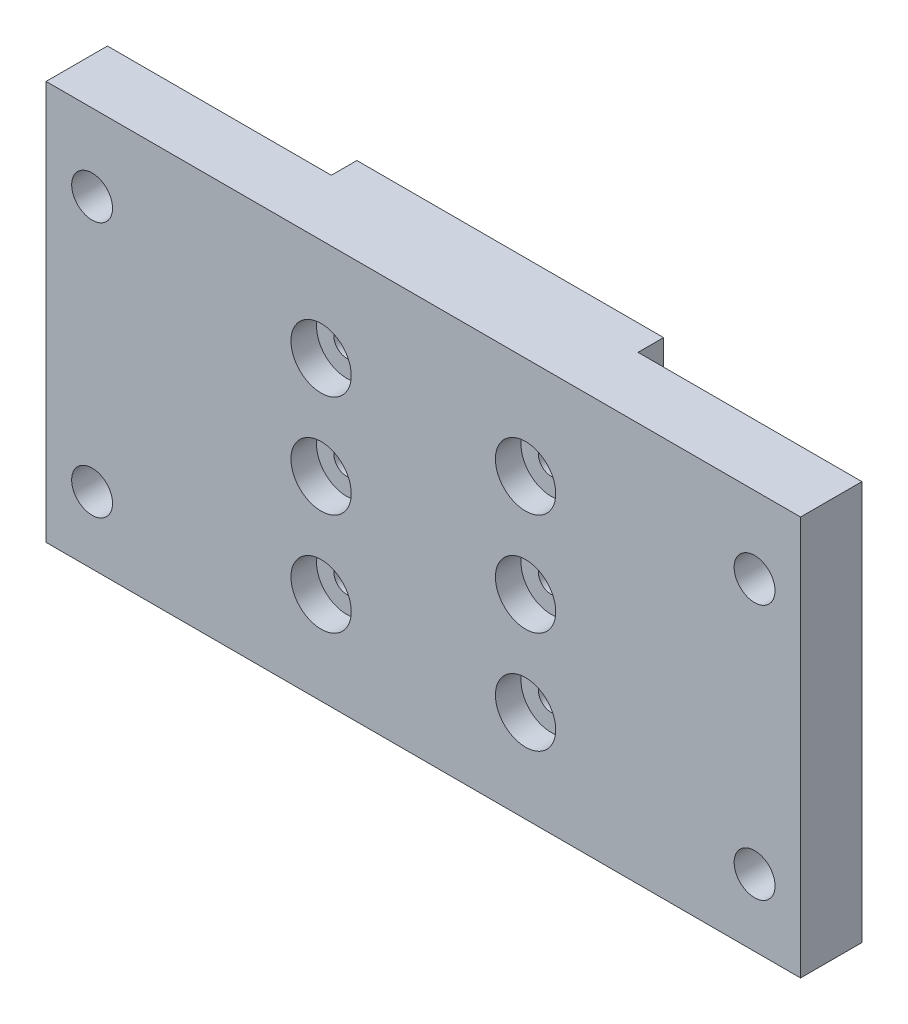
from build123d import *

# Parameters (mm, degrees)
SKETCH1_W           = 147.6
SKETCH1_H           = 78.1
BOSS_EXTRUDE1_DEPTH = 12
SKETCH2_W           = 60
SKETCH2_H           = 78.1
BOSS_EXTRUDE2_DEPTH = 5
SKETCH3_R           = 2.5
CUT_EXTRUDE1_DEPTH  = 86.207643436
SKETCH4_R           = 4
CUT_EXTRUDE2_DEPTH  = 86.207643436
SKETCH5_R           = 5.9
CUT_EXTRUDE3_DEPTH  = 5


with BuildPart() as part:
    # Sketch1 → Boss-Extrude1 (new body)
    with BuildSketch(Plane.XY):
        Rectangle(SKETCH1_W, SKETCH1_H)
    extrude(amount=BOSS_EXTRUDE1_DEPTH)

    # Sketch2 → Boss-Extrude2 (add)
    with BuildSketch(Plane(origin=(0, 0, 0), x_dir=(-1, 0, 0), z_dir=(0, 0, -1))):
        Rectangle(SKETCH2_W, SKETCH2_H)
    extrude(amount=BOSS_EXTRUDE2_DEPTH)

    # Sketch3 → Cut-Extrude1 (cut, through all)
    with BuildSketch(Plane(origin=(0, 0, -5), x_dir=(-1, 0, 0), z_dir=(0, 0, -1))):
        with Locations((-20, 19.05)):
            Circle(SKETCH3_R)
        with Locations((-20, -0.95)):
            Circle(SKETCH3_R)
        with Locations((-20, -20.95)):
            Circle(SKETCH3_R)
        with Locations(Location((20, -20.95, 0), (0, 0, 180))):
            Circle(SKETCH3_R)
        with Locations(Location((20, -0.95, 0), (0, 0, 180))):
            Circle(SKETCH3_R)
        with Locations(Location((20, 19.05, 0), (0, 0, 180))):
            Circle(SKETCH3_R)
    extrude(amount=-CUT_EXTRUDE1_DEPTH, mode=Mode.SUBTRACT)

    # Sketch4 → Cut-Extrude2 (cut, through all)
    with BuildSketch(Plane.XY.offset(12)):
        with Locations((64.8, 24.05)):
            Circle(SKETCH4_R)
        with Locations((64.8, -25.95)):
            Circle(SKETCH4_R)
        with Locations(Location((-64.8, -25.95, 0), (0, 0, 180))):
            Circle(SKETCH4_R)
        with Locations(Location((-64.8, 24.05, 0), (0, 0, 180))):
            Circle(SKETCH4_R)
    extrude(amount=-CUT_EXTRUDE2_DEPTH, mode=Mode.SUBTRACT)

    # Sketch5 → Cut-Extrude3 (cut)
    with BuildSketch(Plane.XY.offset(12)):
        with Locations((-20, 19.05)):
            Circle(SKETCH5_R)
        with Locations((20, 19.05)):
            Circle(SKETCH5_R)
        with Locations((-20, -0.95)):
            Circle(SKETCH5_R)
        with Locations((20, -0.95)):
            Circle(SKETCH5_R)
        with Locations((-20, -20.95)):
            Circle(SKETCH5_R)
        with Locations((20, -20.95)):
            Circle(SKETCH5_R)
    extrude(amount=-CUT_EXTRUDE3_DEPTH, mode=Mode.SUBTRACT)


solid = part.part
